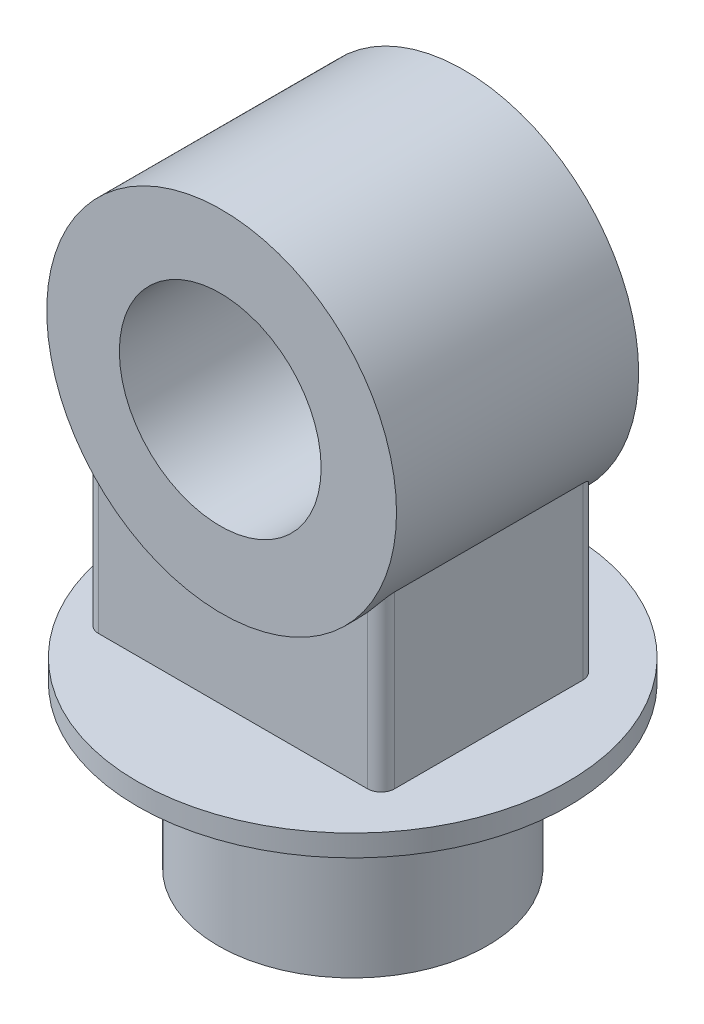
from build123d import *

# Parameters (mm, degrees)
SKETCH2_R                = 100
BOSS_EXTRUDE1_DEPTH      = 120
SKETCH3_R                = 160
BOSS_EXTRUDE2_DEPTH      = 16
SKETCH5_R                = 130
SKETCH5_R_2              = 75
BOSS_EXTRUDE3_DEPTH      = 90
BOSS_EXTRUDE4_REACH      = 401.794
BOSS_EXTRUDE4_END_RADIUS = 130
SKETCH6_W                = 220
SKETCH6_H                = 160
FILLET1_R                = 10


with BuildPart() as part:
    # Sketch2 → Boss-Extrude1 (new body)
    with BuildSketch(Plane(origin=(0, 0, 0), x_dir=(1, 0, 0), z_dir=(0, 1, 0))):
        with Locations(Location((0.261683243, 0.036180985, 0), (0, 0, 270))):
            Circle(SKETCH2_R)
    extrude(amount=BOSS_EXTRUDE1_DEPTH)

    # Sketch3 → Boss-Extrude2 (add)
    with BuildSketch(Plane(origin=(0, 120, 0), x_dir=(1, 0, 0), z_dir=(0, 1, 0))):
        with Locations(Location((0.527861333, -0.229997105, 0), (0, 0, 270))):
            Circle(SKETCH3_R)
    extrude(amount=BOSS_EXTRUDE2_DEPTH)



with BuildPart() as body_2:
    # Sketch5 → Boss-Extrude3 (new, symmetric)
    with BuildSketch(Plane.XY):
        with Locations(Location((-7.162571242, 335.229832199, 0), (0, 0, 180))):
            Circle(SKETCH5_R)
        with Locations(Location((-8.194202002, 336, 0), (0, 0, 180))):
            Circle(SKETCH5_R_2, mode=Mode.SUBTRACT)
    extrude(amount=BOSS_EXTRUDE3_DEPTH, both=True)


with BuildPart() as part_1:
    add(part.part)

    add(body_2.part)  # Boss-Extrude4 merges body 2
    # Boss-Extrude4: up to this cylinder (the profile starts outside it)
    boss_extrude4_end = Plane(origin=(-7.162571242, 335.229832199, -0.621773), z_dir=(0, 0, -1)) * Cylinder(BOSS_EXTRUDE4_END_RADIUS, 1064.588, mode=Mode.PRIVATE)
    # Sketch6 → Boss-Extrude4 (add, up to the surface)
    with BuildSketch(Plane(origin=(0, 136, 0), x_dir=(1, 0, 0), z_dir=(0, 1, 0)), mode=Mode.PRIVATE) as boss_extrude4_sk1:
        with Locations((-9.267492371, 0.621772782)):
            Rectangle(SKETCH6_W, SKETCH6_H)
    boss_extrude4_tool1 = extrude(boss_extrude4_sk1.sketch, amount=BOSS_EXTRUDE4_REACH, mode=Mode.PRIVATE) - boss_extrude4_end
    add(boss_extrude4_tool1.solids().sort_by_distance((-9.267492, 136, -0.621773))[0])

    # Fillet1
    fillet1_edges = [part_1.edges().sort_by_distance(p)[0] for p in [
        (-119.267492371, 202.704102304, 79.378227218),
        (-119.267492371, 202.704102304, -80.621772782),
        (100.732507629, 199.356634441, 79.378227218),
        (100.732507629, 199.356634441, -80.621772782),
    ]]
    fillet(fillet1_edges, radius=FILLET1_R)


solid = part_1.part
